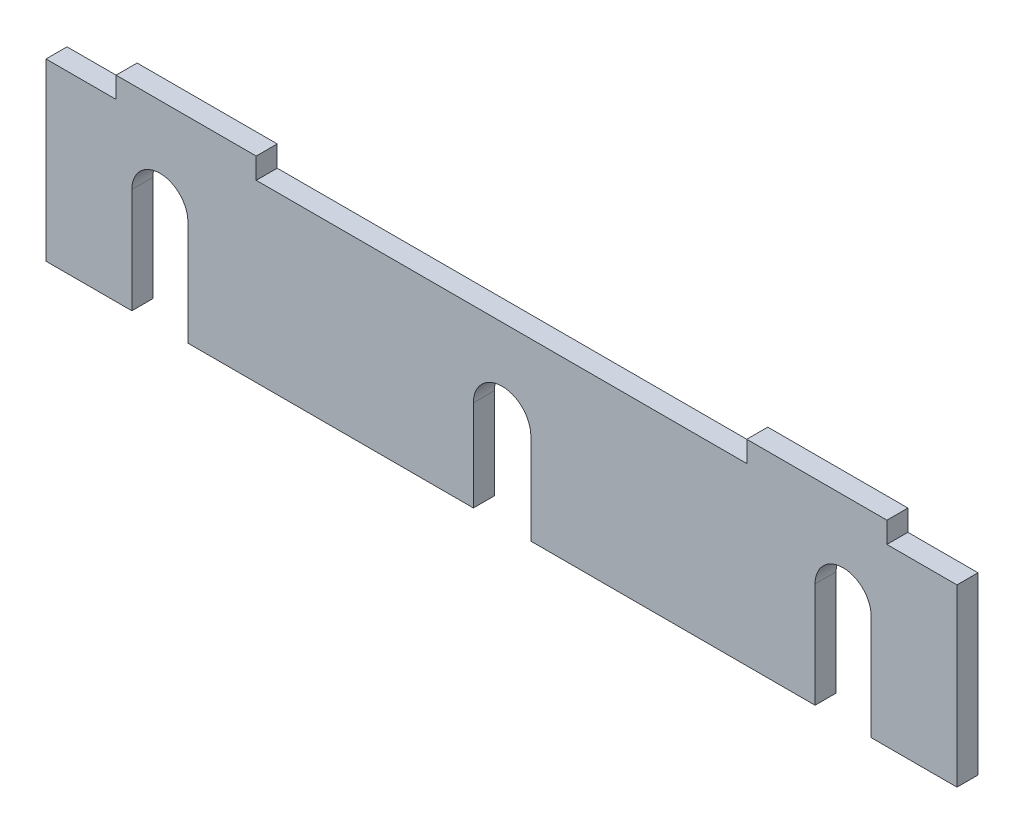
from build123d import *

# Parameters (mm, degrees)
BOSS_EXTRUDE1_DEPTH = 3


with BuildPart() as part:
    # Sketch1 → Boss-Extrude1 (new body)
    with BuildSketch(Plane.XY):
        with BuildLine():
            Line((0, 0), (10, 0))
            Line((10, 0), (10, 3))
            Line((10, 3), (30, 3))
            Line((30, 3), (30, 0))
            Line((30, 0), (100, 0))
            Line((100, 0), (100, 3))
            Line((100, 3), (120, 3))
            Line((120, 3), (120, 0))
            Line((120, 0), (130, 0))
            Line((130, 0), (130, -25))
            Line((130, -25), (117.75, -25))
            Line((117.75, -25), (117.75, -10))
            ThreePointArc((117.75, -10), (113.75, -6), (109.75, -10))
            Line((109.75, -10), (109.75, -25))
            Line((109.75, -25), (69.19, -25))
            Line((69.19, -25), (69.19, -12))
            ThreePointArc((69.19, -12), (65.09, -7.9), (60.99, -12))
            Line((60.99, -12), (60.99, -25))
            Line((60.99, -25), (20.25, -25))
            Line((20.25, -25), (20.25, -10))
            ThreePointArc((20.25, -10), (16.25, -6), (12.25, -10))
            Line((12.25, -10), (12.25, -25))
            Line((12.25, -25), (0, -25))
            Line((0, -25), (0, 0))
        make_face()
    extrude(amount=BOSS_EXTRUDE1_DEPTH)


solid = part.part
